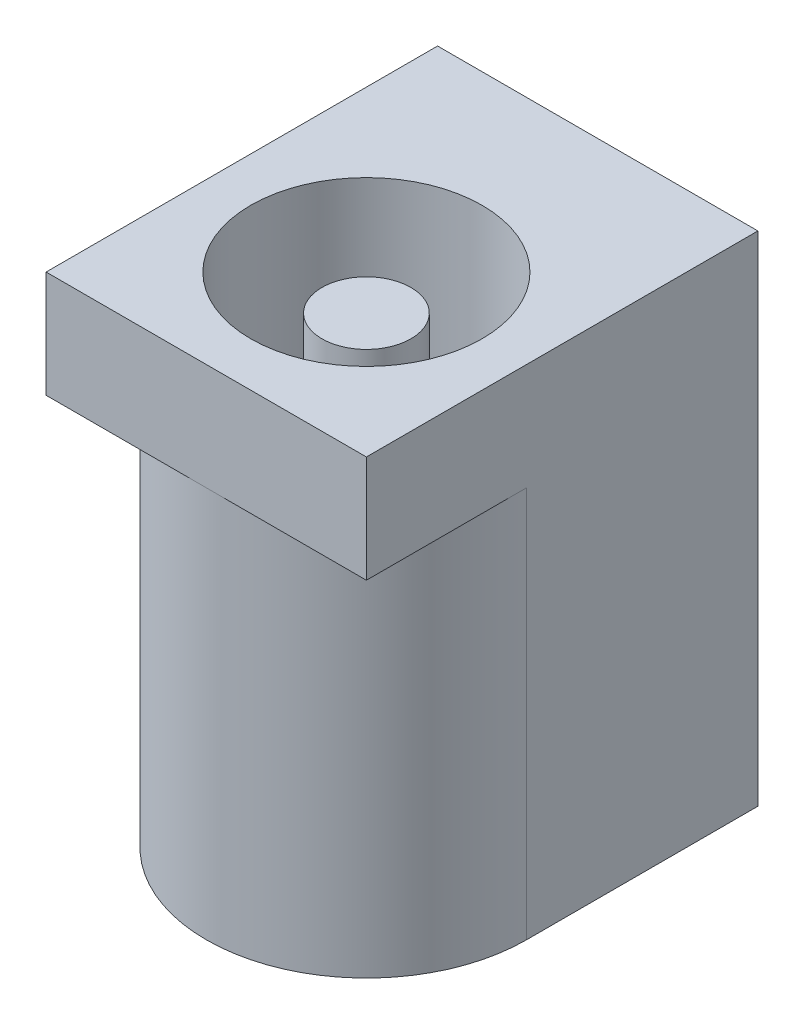
from build123d import *

# Parameters (mm, degrees)
SKETCH1_W           = 9
SKETCH1_H           = 3
BOSS_EXTRUDE1_DEPTH = 11
BOSS_EXTRUDE2_DEPTH = 11
SKETCH3_R           = 3.25
CUT_EXTRUDE1_DEPTH  = 13
SKETCH4_R           = 1.25
BOSS_EXTRUDE3_DEPTH = 12


with BuildPart() as part:
    # Sketch1 → Boss-Extrude1 (new body)
    with BuildSketch(Plane.XY):
        with Locations((0, 1.5)):
            Rectangle(SKETCH1_W, SKETCH1_H)
    extrude(amount=BOSS_EXTRUDE1_DEPTH)

    # Sketch2 → Boss-Extrude2 (add)
    with BuildSketch(Plane.XZ):
        with BuildLine():
            Line((-4.5, 0), (4.5, 0))
            Line((4.5, 0), (4.5, 6.5))
            ThreePointArc((4.5, 6.5), (0, 11), (-4.5, 6.5))
            Line((-4.5, 6.5), (-4.5, 0))
        make_face()
    extrude(amount=BOSS_EXTRUDE2_DEPTH)

    # Sketch3 → Cut-Extrude1 (cut)
    with BuildSketch(Plane(origin=(0, 3, 0), x_dir=(1, 0, 0), z_dir=(0, 1, 0))):
        with Locations(Location((0, -6.5, 0), (0, 0, 180))):
            Circle(SKETCH3_R)
    extrude(amount=-CUT_EXTRUDE1_DEPTH, mode=Mode.SUBTRACT)

    # Sketch4 → Boss-Extrude3 (add)
    with BuildSketch(Plane(origin=(0, -10, 0), x_dir=(1, 0, 0), z_dir=(0, 1, 0))):
        with Locations((0, -6.5)):
            Circle(SKETCH4_R)
    extrude(amount=BOSS_EXTRUDE3_DEPTH)


solid = part.part
